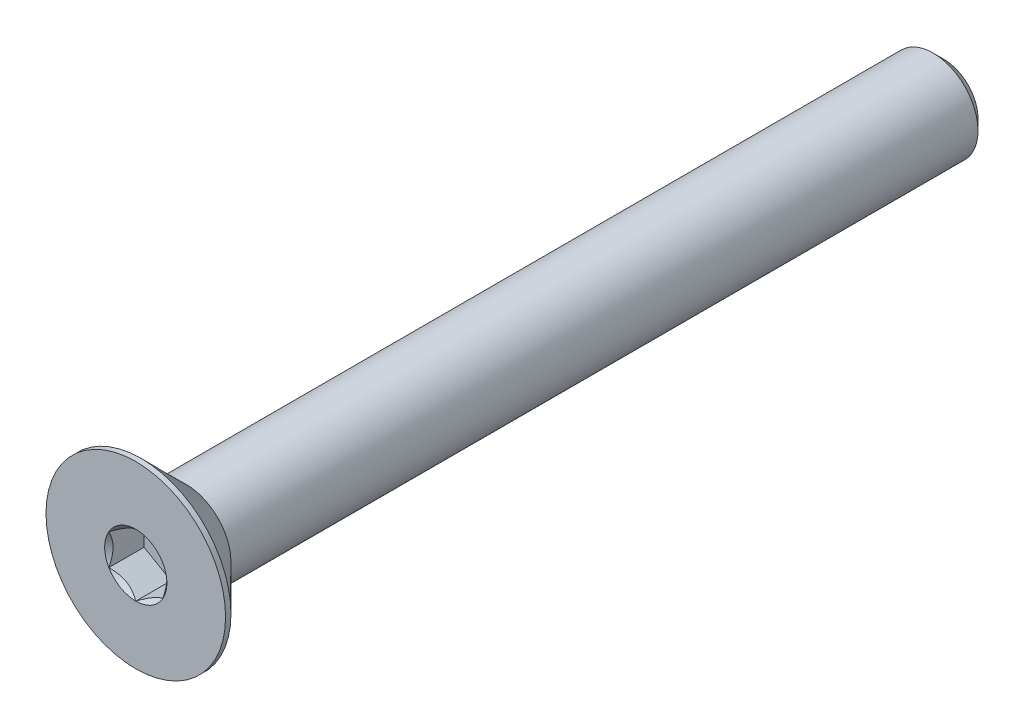
from build123d import *

# Parameters (mm, degrees)
SKETCH1_W          = 45
SKETCH1_H          = 2.5
CHAMFER1_SIZE      = 0.6
CUT_EXTRUDE2_DEPTH = 1.96


with BuildPart() as part:
    # Sketch1 → Revolve1 (revolve)
    with BuildSketch(Plane(origin=(0, 0, 0), x_dir=(0, 0, -1), z_dir=(1, 0, 0))):
        with Locations((22.5, 1.25)):
            Rectangle(SKETCH1_W, SKETCH1_H)
    revolve(axis=Axis((0, 0, -45), (0, 0, 1)))

    # Chamfer1
    chamfer1_edges = [part.edges().sort_by_distance(p)[0] for p in [
        (0, -2.5, -45),
    ]]
    chamfer(chamfer1_edges, length=CHAMFER1_SIZE)

    # Sketch7 → Revolve2 (revolve)
    with BuildSketch(Plane(origin=(0, 0, 0), x_dir=(0, 0, -1), z_dir=(1, 0, 0)), mode=Mode.PRIVATE) as revolve2_sk:
        Polygon((0, 5), (0.3, 5), (2.8, 2.5), (2.8, 0), (0, 0), align=None)
    revolve(revolve2_sk.sketch.rotate(Axis((0, 0, 0), (0, 0, -1)), 180), axis=Axis((0, 0, 0), (0, 0, -1)))

    # Boss-Extrude1 cone 1 section (through the dimple's axis) → Boss-Extrude1 (revolve)
    with BuildSketch(Plane(origin=(0, 0, -2.8), x_dir=(0, -1, 0), z_dir=(1, 0, 0))):
        Polygon((0, 0), (2.5, 0), (0, 2.5), align=None)
    revolve(axis=Axis((0, 0, -2.8), (0, 0, -1)))

    # Sketch5 → Cut-Extrude2 (cut)
    with BuildSketch(Plane.XY):
        Polygon((1.5, -0.866025404), (1.5, 0.866025404), (0, 1.732050808), (-1.5, 0.866025404), (-1.5, -0.866025404), (0, -1.732050808), align=None)
    extrude(amount=-CUT_EXTRUDE2_DEPTH, mode=Mode.SUBTRACT)

    # Cut-Extrude3 cone 1 section (through the dimple's axis) → Cut-Extrude3 (revolve, cut)
    with BuildSketch(Plane(origin=(0, 0, 0), x_dir=(0, -1, 0), z_dir=(1, 0, 0))):
        Polygon((0, 0), (1.732050808, 0), (0, 1.732050808), align=None)
    revolve(axis=Axis((0, 0, 0), (0, 0, -1)), mode=Mode.SUBTRACT)


solid = part.part
